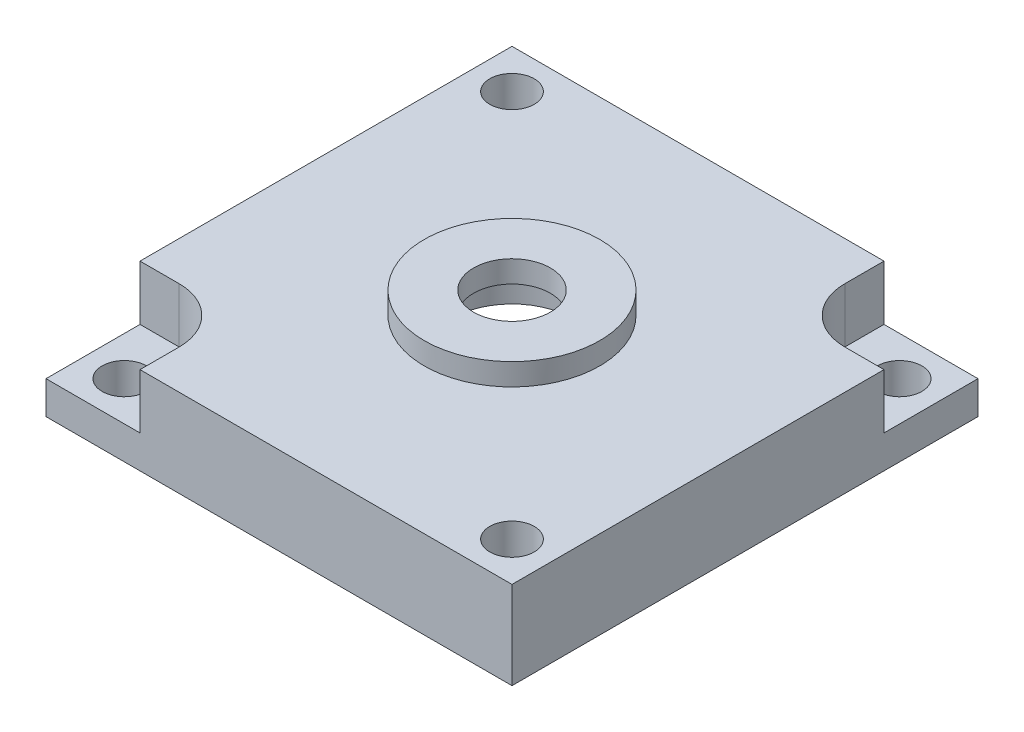
from build123d import *

# Parameters (mm, degrees)
SKETCH_1_W          = 42.5
SKETCH_1_H          = 42.5
SKETCH_1_R          = 2.025
SKETCH_1_R_2        = 18.5
EXTRUDE_1_DEPTH     = 5
EXTRUDE_START       = 5
SKETCH_1_3_W        = 42.5
SKETCH_1_3_H        = 42.5
SKETCH_1_3_R        = 2.025
SKETCH_1_3_R_2      = 18.5
SKETCH_1_3_R_3      = 5.515
EXTRUDE_2_DEPTH     = 3
CUT_EXTRUDE_1_DEPTH = 5
SKETCH_3_R          = 8
SKETCH_3_R_2        = 3.5
EXTRUDE_3_DEPTH     = 2


with BuildPart() as part:
    # 草图1 → 凸台-拉伸1 (new body)
    with BuildSketch(Plane(origin=(0, 0, 0), x_dir=(1, 0, 0), z_dir=(0, 1, 0))):
        Rectangle(SKETCH_1_W, SKETCH_1_H)
        with Locations(Location((-17.67766953, -17.67766953, 0), (0, 0, 270))):
            Circle(SKETCH_1_R, mode=Mode.SUBTRACT)
        with Locations(Location((17.67766953, -17.67766953, 0), (0, 0, 270))):
            Circle(SKETCH_1_R, mode=Mode.SUBTRACT)
        with Locations(Location((17.67766953, 17.67766953, 0), (0, 0, 270))):
            Circle(SKETCH_1_R, mode=Mode.SUBTRACT)
        with Locations(Location((-17.67766953, 17.67766953, 0), (0, 0, 270))):
            Circle(SKETCH_1_R, mode=Mode.SUBTRACT)
        with Locations(Location((0, 0, 0), (0, 0, 270))):
            Circle(SKETCH_1_R_2, mode=Mode.SUBTRACT)
    extrude(amount=EXTRUDE_1_DEPTH)

    # 草图1<3> → 凸台-拉伸2 (add)
    # profile 1 of 2: a face of its own
    with BuildSketch(Plane(origin=(0, 0, 0), x_dir=(1, 0, 0), z_dir=(0, 1, 0)).offset(EXTRUDE_START)):
        Rectangle(SKETCH_1_3_W, SKETCH_1_3_H)
        with Locations(Location((-17.67766953, -17.67766953, 0), (0, 0, 270))):
            Circle(SKETCH_1_3_R, mode=Mode.SUBTRACT)
        with Locations(Location((17.67766953, -17.67766953, 0), (0, 0, 270))):
            Circle(SKETCH_1_3_R, mode=Mode.SUBTRACT)
        with Locations(Location((17.67766953, 17.67766953, 0), (0, 0, 270))):
            Circle(SKETCH_1_3_R, mode=Mode.SUBTRACT)
        with Locations(Location((-17.67766953, 17.67766953, 0), (0, 0, 270))):
            Circle(SKETCH_1_3_R, mode=Mode.SUBTRACT)
        with Locations(Location((0, 0, 0), (0, 0, 270))):
            Circle(SKETCH_1_3_R_2, mode=Mode.SUBTRACT)
    # profile 2 of 2: a face of its own
    with BuildSketch(Plane(origin=(0, 0, 0), x_dir=(1, 0, 0), z_dir=(0, 1, 0)).offset(EXTRUDE_START)):
        with Locations(Location((0, 0, 0), (0, 0, 270))):
            Circle(SKETCH_1_3_R_2)
        with Locations(Location((0, 0, 0), (0, 0, 270))):
            Circle(SKETCH_1_3_R_3, mode=Mode.SUBTRACT)
    extrude(amount=EXTRUDE_2_DEPTH)

    # 草图2 → 切除-拉伸1 (cut)
    with BuildSketch(Plane(origin=(0, 8, 0), x_dir=(1, 0, 0), z_dir=(0, 1, 0))):
        with BuildLine():
            Line((-17.67766953, -12.67766953), (-21.25, -12.67766953))
            Line((-21.25, -12.67766953), (-21.25, -21.25))
            Line((-21.25, -21.25), (-12.67766953, -21.25))
            Line((-12.67766953, -21.25), (-12.67766953, -17.67766953))
            ThreePointArc((-12.67766953, -17.67766953), (-14.142135624, -14.142135624), (-17.67766953, -12.67766953))
        make_face()
        with BuildLine():
            Line((21.25, 21.25), (12.67766953, 21.25))
            Line((12.67766953, 21.25), (12.67766953, 17.67766953))
            ThreePointArc((12.67766953, 17.67766953), (14.142135624, 14.142135624), (17.67766953, 12.67766953))
            Line((17.67766953, 12.67766953), (21.25, 12.67766953))
            Line((21.25, 12.67766953), (21.25, 21.25))
        make_face()
    extrude(amount=-CUT_EXTRUDE_1_DEPTH, mode=Mode.SUBTRACT)

    # 草图3 → 凸台-拉伸3 (add)
    with BuildSketch(Plane(origin=(0, 8, 0), x_dir=(1, 0, 0), z_dir=(0, 1, 0))):
        with Locations(Location((0, 0, 0), (0, 0, 90))):
            Circle(SKETCH_3_R)
        with Locations(Location((0, 0, 0), (0, 0, 270))):
            Circle(SKETCH_3_R_2, mode=Mode.SUBTRACT)
    extrude(amount=EXTRUDE_3_DEPTH)


solid = part.part
